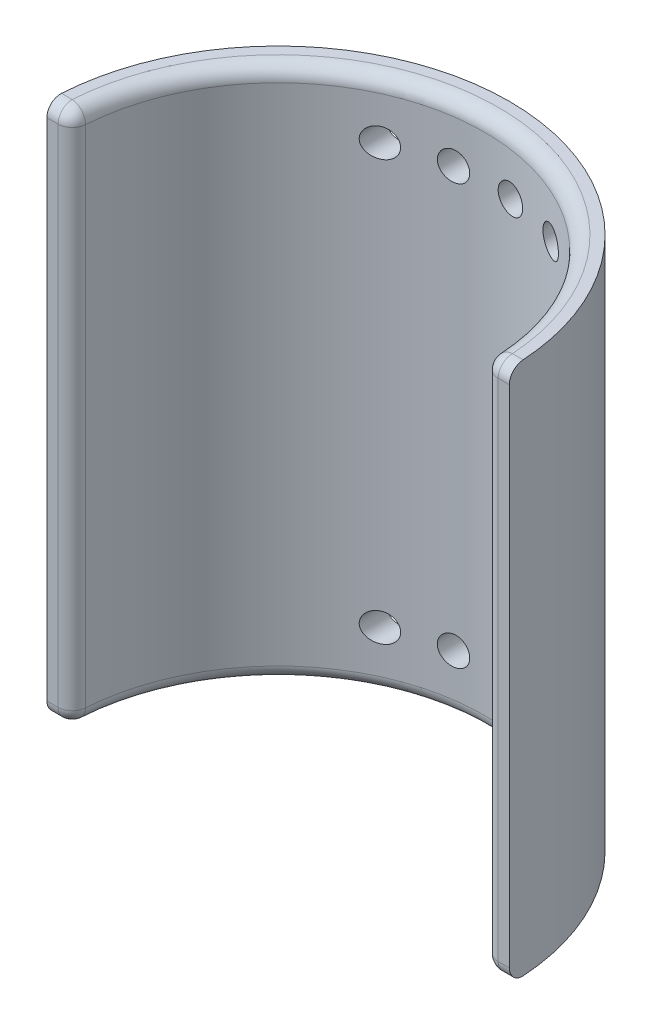
from build123d import *

# Parameters (mm, degrees)
SKETCH_2_R          = 32.5
EXTRUDE_1_DEPTH     = 75
SKETCH_3_R          = 29
CUT_EXTRUDE_1_DEPTH = 142.5
SKETCH_4_W          = 65
SKETCH_4_H          = 75
CUT_EXTRUDE_2_DEPTH = 50
SKETCH_5_R          = 2
CUT_EXTRUDE_3_DEPTH = 50
FILLET_1_R          = 2
FILLET_2_R          = 2
FILLET_3_R          = 2


with BuildPart() as part:
    # 草圖2 → 填料-伸長1 (new body)
    with BuildSketch(Plane(origin=(0, 0, 0), x_dir=(1, 0, 0), z_dir=(0, 1, 0))):
        with Locations(Location((0, 0, 0), (0, 0, 270))):
            Circle(SKETCH_2_R)
    extrude(amount=EXTRUDE_1_DEPTH)

    # 草圖3 → 除料-伸長1 (cut, symmetric)
    with BuildSketch(Plane(origin=(0, 75, 0), x_dir=(1, 0, 0), z_dir=(0, 1, 0))):
        with Locations(Location((0, 0, 0), (0, 0, 270))):
            Circle(SKETCH_3_R)
    extrude(amount=CUT_EXTRUDE_1_DEPTH, both=True, mode=Mode.SUBTRACT)

    # 草圖4 → 除料-伸長2 (cut)
    with BuildSketch(Plane.XY):
        with Locations((0, 37.5)):
            Rectangle(SKETCH_4_W, SKETCH_4_H)
    extrude(amount=CUT_EXTRUDE_2_DEPTH, mode=Mode.SUBTRACT)

    # 草圖5 → 除料-伸長3 (cut)
    with BuildSketch(Plane.XY):
        with Locations((-4, 67)):
            Circle(SKETCH_5_R)
        with Locations((4, 67)):
            Circle(SKETCH_5_R)
        with Locations((12, 67)):
            Circle(SKETCH_5_R)
        with Locations((-12, 67)):
            Circle(SKETCH_5_R)
        with Locations((-12, 8)):
            Circle(SKETCH_5_R)
        with Locations((12, 8)):
            Circle(SKETCH_5_R)
        with Locations((4, 8)):
            Circle(SKETCH_5_R)
        with Locations((-4, 8)):
            Circle(SKETCH_5_R)
    extrude(amount=-CUT_EXTRUDE_3_DEPTH, mode=Mode.SUBTRACT)

    # 圓角1
    fillet_1_edges = [part.edges().sort_by_distance(p)[0] for p in [
        (-29, 37.5, 0),
        (29, 37.5, 0),
    ]]
    fillet(fillet_1_edges, radius=FILLET_1_R)

    # 圓角2
    fillet_2_edges = [part.edges().sort_by_distance(p)[0] for p in [
        (31.717708298, 75, 0),
        (0, 75, -29),
        (-31.717708298, 75, 0),
        (-29.567583368, 75, -0.540879629),
        (29.567583368, 75, -0.540879629),
    ]]
    fillet(fillet_2_edges, radius=FILLET_2_R)

    # 圓角3
    fillet_3_edges = [part.edges().sort_by_distance(p)[0] for p in [
        (-31.717708298, 0, 0),
        (31.717708298, 0, 0),
        (0, 0, -29),
        (-29.567583368, 0, -0.540879629),
        (29.567583368, 0, -0.540879629),
    ]]
    fillet(fillet_3_edges, radius=FILLET_3_R)


solid = part.part
